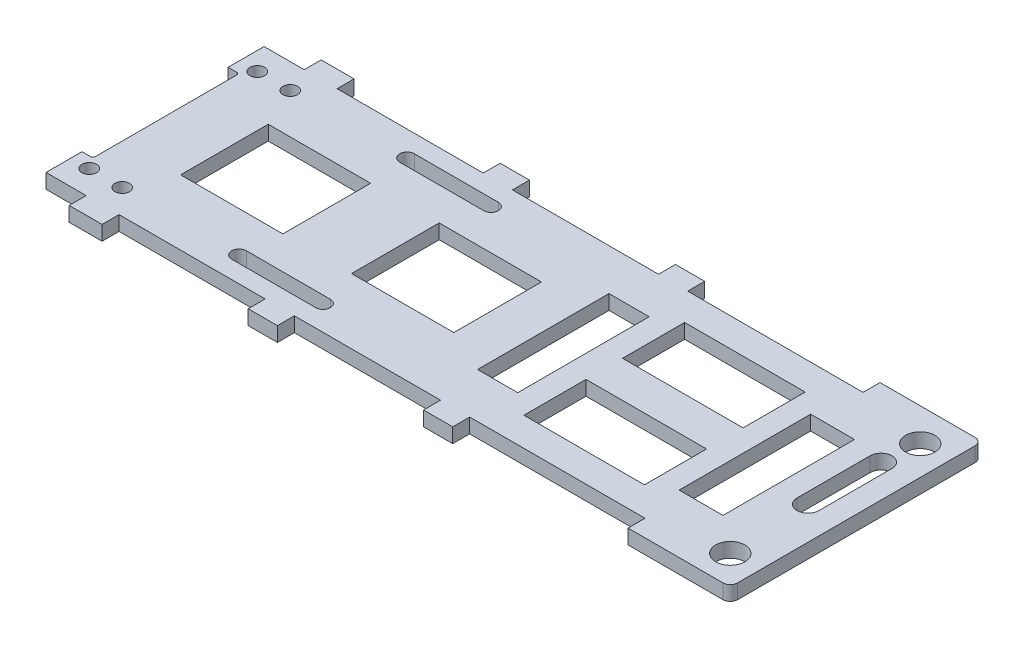
from build123d import *

# Parameters (mm, degrees)
TOP_PLATE_R             = 1
TOP_PLATE_R_2           = 2
TOP_PLATE_W             = 16.5
TOP_PLATE_H             = 8.5
TOP_PLATE_W_2           = 6
TOP_PLATE_H_2           = 18
TOP_PLATE_W_3           = 14
TOP_PLATE_H_3           = 12
TOP_PLATE_EXTRUDE_DEPTH = 2


with BuildPart() as part:
    # Top Plate → Top Plate Extrude (new body)
    with BuildSketch(Plane(origin=(0, 0, 0), x_dir=(1, 0, 0), z_dir=(0, 1, 0))):
        with BuildLine():
            Line((-38, 17.25), (-42.5, 17.25))
            Line((-42.5, 17.25), (-42.5, 14.926611549))
            Line((-42.5, 14.926611549), (-48, 14.926611549))
            Line((-48, 14.926611549), (-48, 10))
            Line((-48, 10), (-46.8, 10))
            ThreePointArc((-46.8, 10), (-46.587867966, 9.912132034), (-46.5, 9.7))
            Line((-46.5, 9.7), (-46.5, -9.7))
            ThreePointArc((-46.5, -9.7), (-46.587867966, -9.912132034), (-46.8, -10))
            Line((-46.8, -10), (-48, -10))
            Line((-48, -10), (-48, -14.926611549))
            Line((-48, -14.926611549), (-42.5, -14.926611549))
            Line((-42.5, -14.926611549), (-42.5, -17.25))
            Line((-42.5, -17.25), (-38, -17.25))
            Line((-38, -17.25), (-38, -14.926611549))
            Line((-38, -14.926611549), (-18, -14.926611549))
            Line((-18, -14.926611549), (-18, -17.25))
            Line((-18, -17.25), (-14, -17.25))
            Line((-14, -17.25), (-14, -14.926611549))
            Line((-14, -14.926611549), (6, -14.926611549))
            Line((6, -14.926611549), (6, -17.25))
            Line((6, -17.25), (10, -17.25))
            Line((10, -17.25), (10, -14.926611549))
            Line((10, -14.926611549), (34, -14.926611549))
            Line((34, -14.926611549), (34, -17.25))
            Line((34, -17.25), (47, -17.25))
            ThreePointArc((47, -17.25), (47.707106781, -16.957106781), (48, -16.25))
            Line((48, -16.25), (48, 16.25))
            ThreePointArc((48, 16.25), (47.707106781, 16.957106781), (47, 17.25))
            Line((47, 17.25), (34, 17.25))
            Line((34, 17.25), (34, 14.926611549))
            Line((34, 14.926611549), (10, 14.926611549))
            Line((10, 14.926611549), (10, 17.25))
            Line((10, 17.25), (6, 17.25))
            Line((6, 17.25), (6, 14.926611549))
            Line((6, 14.926611549), (-14, 14.926611549))
            Line((-14, 14.926611549), (-14, 17.25))
            Line((-14, 17.25), (-18, 17.25))
            Line((-18, 17.25), (-18, 14.926611549))
            Line((-18, 14.926611549), (-38, 14.926611549))
            Line((-38, 14.926611549), (-38, 17.25))
        make_face()
        with Locations(Location((-45.5, -11.5, 0), (0, 0, 270))):
            Circle(TOP_PLATE_R, mode=Mode.SUBTRACT)
        with Locations(Location((-41, -11.5, 0), (0, 0, 270))):
            Circle(TOP_PLATE_R, mode=Mode.SUBTRACT)
        with BuildLine():
            Line((-25, -10.5), (-13.5, -10.5))
            ThreePointArc((-13.5, -10.5), (-12.5, -11.5), (-13.5, -12.5))
            Line((-13.5, -12.5), (-25, -12.5))
            ThreePointArc((-25, -12.5), (-26, -11.5), (-25, -10.5))
        make_face(mode=Mode.SUBTRACT)
        with Locations(Location((44, -13.25, 0), (0, 0, 270))):
            Circle(TOP_PLATE_R_2, mode=Mode.SUBTRACT)
        with Locations((21.75, -6.75)):
            Rectangle(TOP_PLATE_W, TOP_PLATE_H, mode=Mode.SUBTRACT)
        with Locations((36, -0.25)):
            Rectangle(TOP_PLATE_W_2, TOP_PLATE_H_2, mode=Mode.SUBTRACT)
        with Locations((-31.5, 0)):
            Rectangle(TOP_PLATE_W_3, TOP_PLATE_H_3, mode=Mode.SUBTRACT)
        with Locations((-8.098292563, 0)):
            Rectangle(TOP_PLATE_W_3, TOP_PLATE_H_3, mode=Mode.SUBTRACT)
        with Locations(Location((-45.5, 11.5, 0), (0, 0, 270))):
            Circle(TOP_PLATE_R, mode=Mode.SUBTRACT)
        with Locations(Location((-41, 11.5, 0), (0, 0, 270))):
            Circle(TOP_PLATE_R, mode=Mode.SUBTRACT)
        with BuildLine():
            ThreePointArc((-13.5, 12.5), (-12.5, 11.5), (-13.5, 10.5))
            Line((-13.5, 10.5), (-25, 10.5))
            ThreePointArc((-25, 10.5), (-26, 11.5), (-25, 12.5))
            Line((-25, 12.5), (-13.5, 12.5))
        make_face(mode=Mode.SUBTRACT)
        Polygon((4.9, 9.249999917), (10.4, 9.249999917), (10.4, -8.75), (4.901707437, -8.750000002), align=None, mode=Mode.SUBTRACT)
        with Locations((21.75, 6.75)):
            Rectangle(TOP_PLATE_W, TOP_PLATE_H, mode=Mode.SUBTRACT)
        with BuildLine():
            ThreePointArc((42, 7.886262649), (43.5, 9.386262649), (45, 7.886262649))
            Line((45, 7.886262649), (45, -2.113737351))
            ThreePointArc((45, -2.113737351), (43.5, -3.613737351), (42, -2.113737351))
            Line((42, -2.113737351), (42, 7.886262649))
        make_face(mode=Mode.SUBTRACT)
        with Locations(Location((44, 12.75, 0), (0, 0, 270))):
            Circle(TOP_PLATE_R_2, mode=Mode.SUBTRACT)
    extrude(amount=TOP_PLATE_EXTRUDE_DEPTH)


solid = part.part
